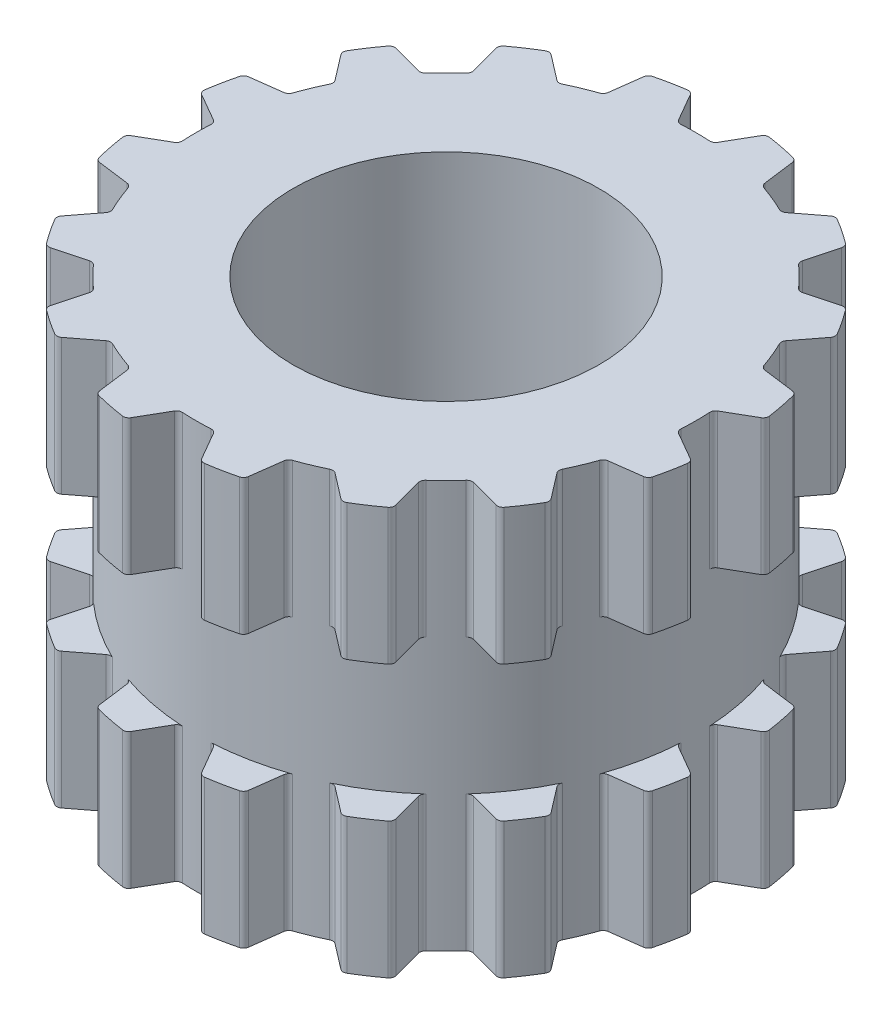
from build123d import *
from build123d.topology import SkipClean

# Parameters (mm, degrees)
BODYS_W               = 2
BODYS_H               = 3
M3X0_5_TAPPED_HOLE1_D = 2.5
MIDBODYCUTS_W         = 0.25
MIDBODYCUTS_H         = 1
GROOVECUT_DEPTH       = 4.201562119
GCCP_COUNT            = 16
SCALE1_SCALE_X        = 1.4
SCALE1_SCALE_Y        = 1.333
SCALE1_SCALE_Z        = 1.4
SKETCH4_R             = 1.75
SKETCH4_R_2           = 1.5
BOSS_EXTRUDE1_DEPTH   = 3.999


with BuildPart() as part:
    # BodyS → Body (revolve)
    with BuildSketch(Plane.XY, mode=Mode.PRIVATE) as body_sk:
        with Locations((1, 0)):
            Rectangle(BODYS_W, BODYS_H)
    revolve(body_sk.sketch.rotate(Axis((0, -1.5, 0), (0, 1, 0)), 90), axis=Axis((0, -1.5, 0), (0, 1, 0)))

    # M3x0.5 Tapped Hole1 (through all)
    with Locations(Plane(origin=(0, 1.5, 0), x_dir=(1, 0, 0), z_dir=(0, 1, 0))):
        with Locations((0, 0)):
            Hole(M3X0_5_TAPPED_HOLE1_D / 2)

    # MidBodyCutS → MidBodyCut (revolve, cut)
    with BuildSketch(Plane.XY, mode=Mode.PRIVATE) as midbodycut_sk:
        with Locations((1.875, 0)):
            Rectangle(MIDBODYCUTS_W, MIDBODYCUTS_H)
    revolve(midbodycut_sk.sketch.rotate(Axis((0, 5.5, 0), (0, -1, 0)), 270), axis=Axis((0, 5.5, 0), (0, -1, 0)), mode=Mode.SUBTRACT)

    # GrooveCutS → GrooveCut (cut, symmetric)
    with SkipClean():  # the faces are left unmerged after this step: merging them gives an invalid solid
        with BuildSketch(Plane(origin=(0, 0, 0), x_dir=(1, 0, 0), z_dir=(0, 1, 0))):
            with BuildLine():
                Line((0.136871074, 1.767078346), (0.247975811, 1.959517396))
                ThreePointArc((0.247975811, 1.959517396), (0.265173181, 1.975513496), (0.288384518, 1.979099384))
                ThreePointArc((0.288384518, 1.979099384), (0, 2), (-0.288384518, 1.979099384))
                ThreePointArc((-0.288384518, 1.979099384), (-0.265173181, 1.975513496), (-0.247975811, 1.959517396))
                Line((-0.247975811, 1.959517396), (-0.136871074, 1.767078346))
                ThreePointArc((-0.136871074, 1.767078346), (-0.121232286, 1.751880117), (-0.099945587, 1.747143635))
                ThreePointArc((-0.099945587, 1.747143635), (0, 1.75), (0.099945587, 1.747143635))
                ThreePointArc((0.099945587, 1.747143635), (0.121232286, 1.751880117), (0.136871074, 1.767078346))
            make_face()
        groovecut = extrude(amount=GROOVECUT_DEPTH, both=True, mode=Mode.SUBTRACT)

    # GCCP: GrooveCut ×16 about axis
    with SkipClean():  # the faces are left unmerged after this step: merging them gives an invalid solid
        gccp_axis = Axis((0, 0, 0), (0, 1, 0))
        for i in range(1, GCCP_COUNT):
            add(groovecut.rotate(gccp_axis, i * 360 / GCCP_COUNT), mode=Mode.SUBTRACT)


with BuildPart() as part_1:
    # Scale1: scaled about (0, 0, 0)
    add(part.part.scale((SCALE1_SCALE_X, SCALE1_SCALE_Y, SCALE1_SCALE_Z), about=(0, 0, 0)))

    # Sketch4 → Boss-Extrude1 (add)
    with BuildSketch(Plane(origin=(0, 1.9995, 0), x_dir=(1, 0, 0), z_dir=(0, 1, 0))):
        Circle(SKETCH4_R)
        with Locations(Location((0, 0, 0), (0, 0, 270))):
            Circle(SKETCH4_R_2, mode=Mode.SUBTRACT)
    extrude(amount=-BOSS_EXTRUDE1_DEPTH)


solid = part_1.part
